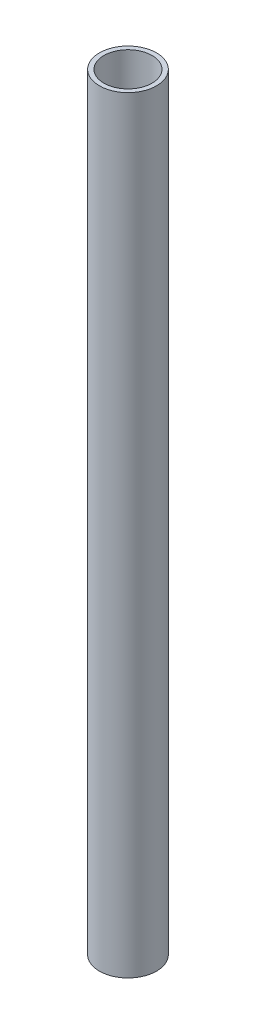
from build123d import *

# Parameters (mm, degrees)
SKETCH1_R           = 19
SKETCH1_R_2         = 16
EXTRUDE_THIN1_DEPTH = 255


with BuildPart() as part:
    # Sketch1 → Extrude-Thin1 (new, symmetric)
    with BuildSketch(Plane(origin=(0, 0, 0), x_dir=(1, 0, 0), z_dir=(0, 1, 0))):
        Circle(SKETCH1_R)
        Circle(SKETCH1_R_2, mode=Mode.SUBTRACT)
    extrude(amount=EXTRUDE_THIN1_DEPTH, both=True)


solid = part.part
